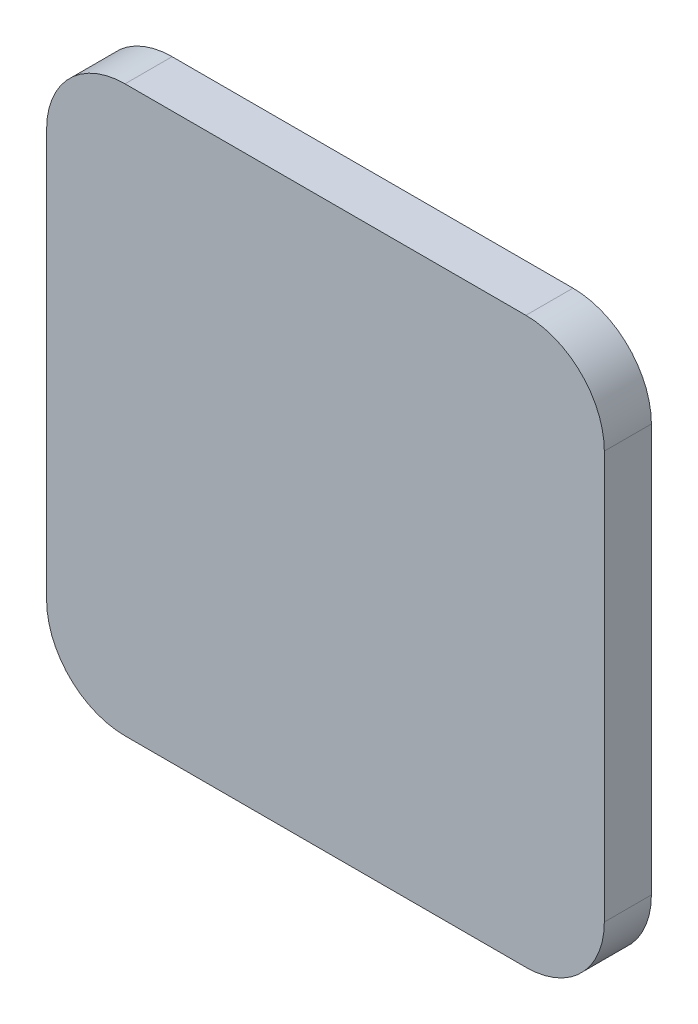
from build123d import *

# Parameters (mm, degrees)
BOSS_EXTRUDE1_DEPTH = 3


with BuildPart() as part:
    # Sketch2 → Boss-Extrude1 (new body)
    with BuildSketch(Plane.XY.offset(6)):
        with BuildLine():
            Line((-12.557097281, 18), (13, 18))
            ThreePointArc((13, 18), (16.535533906, 16.535533906), (18, 13))
            Line((18, 13), (18, -13))
            ThreePointArc((18, -13), (16.535533906, -16.535533906), (13, -18))
            Line((13, -18), (-12.557097281, -18))
            ThreePointArc((-12.557097281, -18), (-16.092631187, -16.535533906), (-17.557097281, -13))
            Line((-17.557097281, -13), (-17.557097281, 13))
            ThreePointArc((-17.557097281, 13), (-16.092631187, 16.535533906), (-12.557097281, 18))
        make_face()
    extrude(amount=BOSS_EXTRUDE1_DEPTH)


solid = part.part
